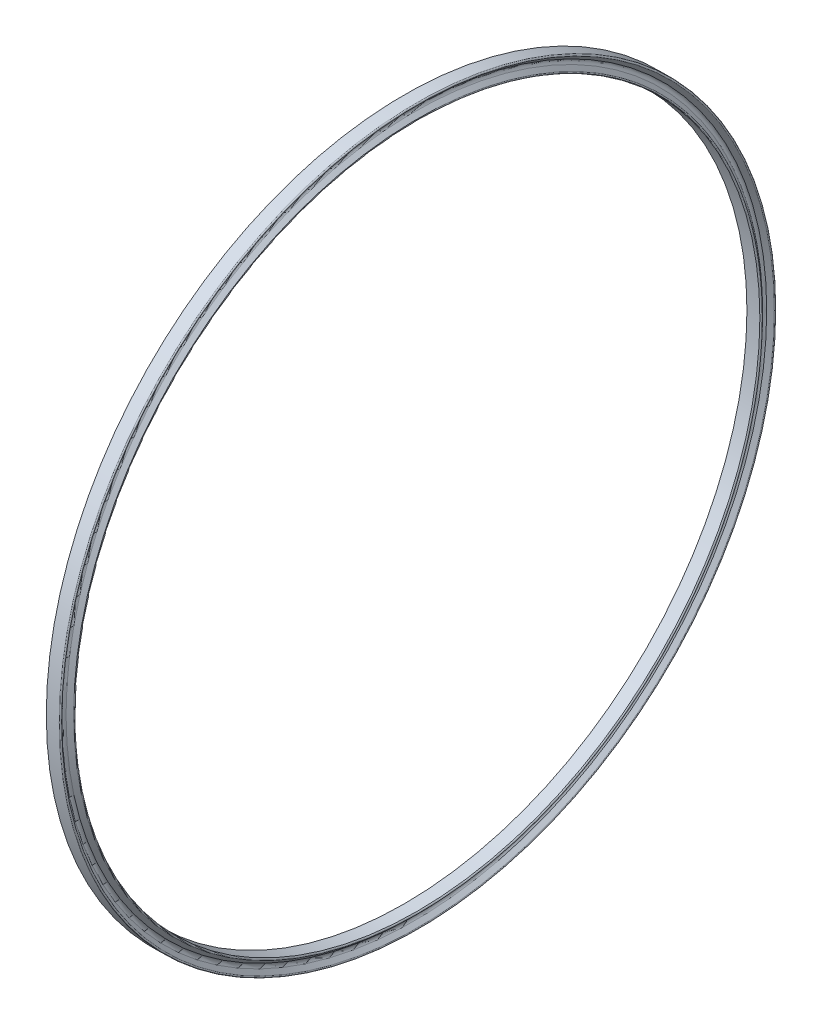
from build123d import *


with BuildPart() as part:
    # Sketch1 → Revolve1 (revolve)
    with BuildSketch(Plane.XY, mode=Mode.PRIVATE) as revolve1_sk:
        with BuildLine():
            Line((27.317488674, -33.33), (26.05891003, -33.33))
            Line((26.05891003, -33.33), (26.05891003, -34.83))
            Line((26.05891003, -34.83), (27.317488674, -34.83))
            ThreePointArc((27.317488674, -34.83), (27.409876627, -34.768268343), (27.388199352, -34.659289322))
            Line((27.388199352, -34.659289322), (27.021042064, -34.292132034))
            ThreePointArc((27.021042064, -34.292132034), (26.933174098, -34.08), (27.021042064, -33.867867966))
            Line((27.021042064, -33.867867966), (27.388199352, -33.500710678))
            ThreePointArc((27.388199352, -33.500710678), (27.409876627, -33.391731657), (27.317488674, -33.33))
        make_face()
    revolve(revolve1_sk.sketch.rotate(Axis((-75.575760541, 0, 0), (1, 0, 0)), 270), axis=Axis((-75.575760541, 0, 0), (1, 0, 0)))


solid = part.part
